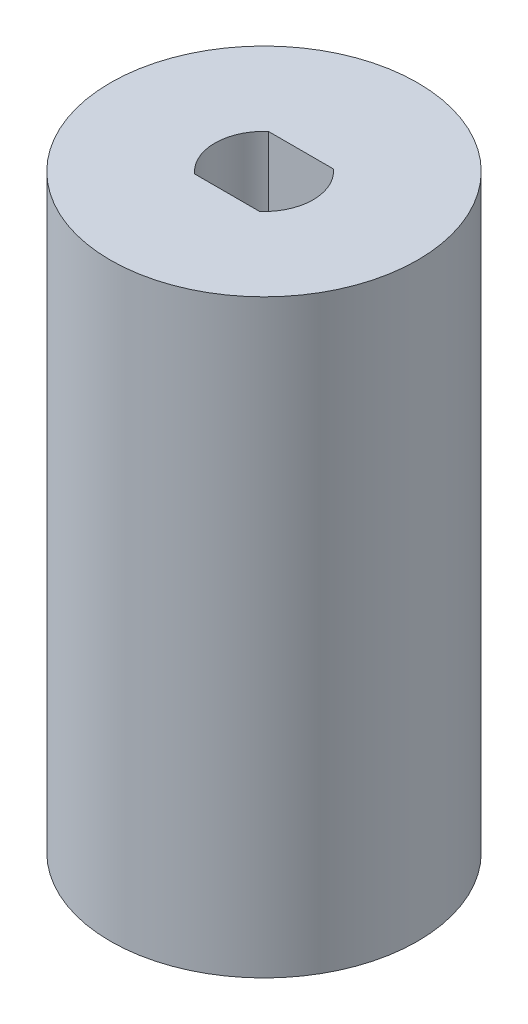
from build123d import *

# Parameters (mm, degrees)
CROQUIS1_R              = 12.5
SALIENTE_EXTRUIR1_DEPTH = 48
CORTAR_EXTRUIR1_DEPTH   = 15
CORTAR_EXTRUIR2_START   = 33
CORTAR_EXTRUIR2_DEPTH   = 15


with BuildPart() as part:
    # Croquis1 → Saliente-Extruir1 (new body)
    with BuildSketch(Plane(origin=(0, 0, 0), x_dir=(1, 0, 0), z_dir=(0, 1, 0))):
        Circle(CROQUIS1_R)
    extrude(amount=SALIENTE_EXTRUIR1_DEPTH)

    # Croquis2 → Cortar-Extruir1 (cut)
    with BuildSketch(Plane(origin=(0, 0, 0), x_dir=(1, 0, 0), z_dir=(0, 1, 0))):
        with BuildLine():
            Line((-2.645751311, -3), (2.645751311, -3))
            ThreePointArc((2.645751311, -3), (4, 0), (2.645751311, 3))
            Line((2.645751311, 3), (-2.645751311, 3))
            ThreePointArc((-2.645751311, 3), (-4, 0), (-2.645751311, -3))
        make_face()
    extrude(amount=CORTAR_EXTRUIR1_DEPTH, mode=Mode.SUBTRACT)

    # Croquis2<2> → Cortar-Extruir2 (cut)
    with BuildSketch(Plane(origin=(0, 0, 0), x_dir=(1, 0, 0), z_dir=(0, 1, 0)).offset(CORTAR_EXTRUIR2_START)):
        with BuildLine():
            Line((-2.645751311, -3), (2.645751311, -3))
            ThreePointArc((2.645751311, -3), (4, 0), (2.645751311, 3))
            Line((2.645751311, 3), (-2.645751311, 3))
            ThreePointArc((-2.645751311, 3), (-4, 0), (-2.645751311, -3))
        make_face()
    extrude(amount=CORTAR_EXTRUIR2_DEPTH, mode=Mode.SUBTRACT)


solid = part.part
